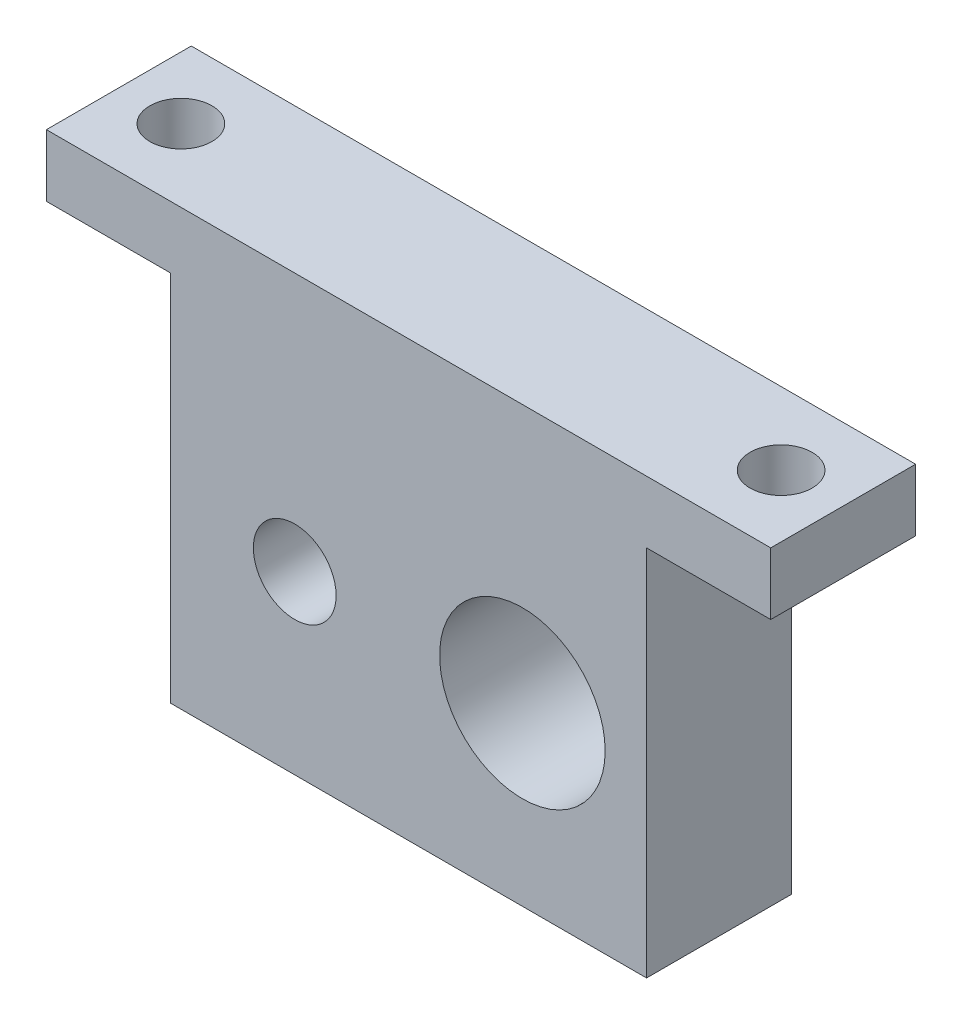
from build123d import *

# Parameters (mm, degrees)
SKETCH_1_R          = 4
SKETCH_1_R_2        = 8
EXTRUDE_1_DEPTH     = 14
SKETCH_2_R          = 3
CUT_EXTRUDE_1_DEPTH = 14


with BuildPart() as part:
    # 草图1 → 凸台-拉伸1 (new body)
    with BuildSketch(Plane.XY):
        Polygon((-35, 21), (-35, 15), (-23, 15), (-23, -21), (23, -21), (23, 15), (35, 15), (35, 21), align=None)
        with Locations((-11, -4)):
            Circle(SKETCH_1_R, mode=Mode.SUBTRACT)
        with Locations((11, -4)):
            Circle(SKETCH_1_R_2, mode=Mode.SUBTRACT)
    extrude(amount=EXTRUDE_1_DEPTH)

    # 草图2 → 切除-拉伸1 (cut)
    with BuildSketch(Plane.XZ.offset(-15)):
        with Locations((-29, 7)):
            Circle(SKETCH_2_R)
        with Locations((29, 7)):
            Circle(SKETCH_2_R)
    extrude(amount=-CUT_EXTRUDE_1_DEPTH, mode=Mode.SUBTRACT)


solid = part.part
